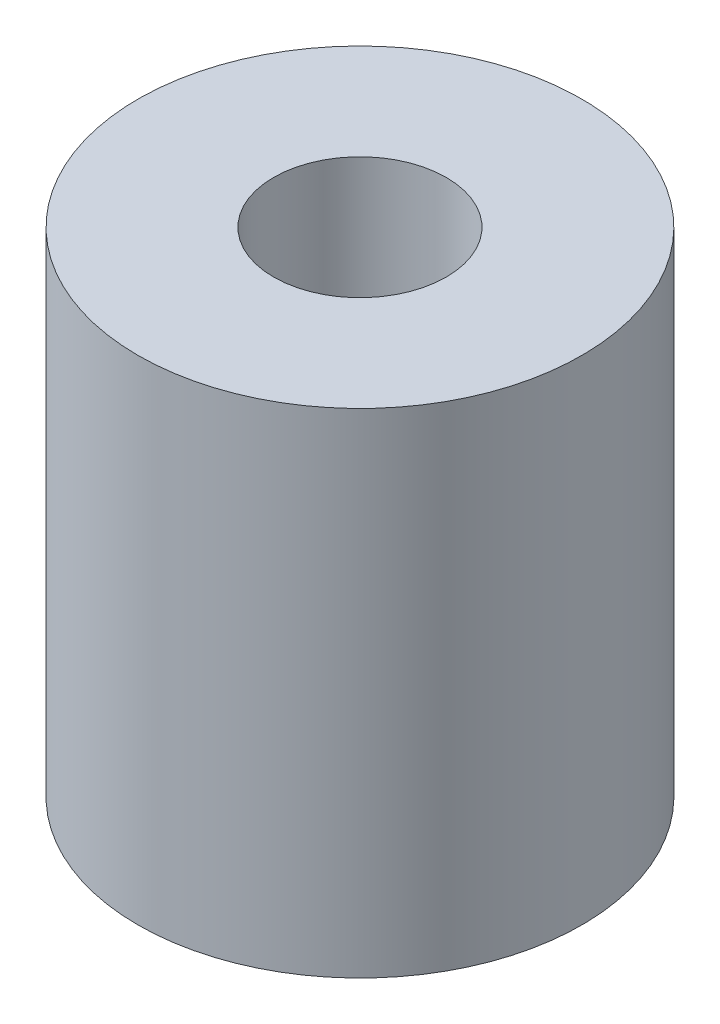
from build123d import *

# Parameters (mm, degrees)
SKETCH_2_R      = 4.5
SKETCH_2_R_2    = 1.75
EXTRUDE_1_DEPTH = 10


with BuildPart() as part:
    # 草图2 → 凸台-拉伸1 (new body)
    with BuildSketch(Plane(origin=(0, 0, 0), x_dir=(1, 0, 0), z_dir=(0, 1, 0))):
        with Locations(Location((0, 0, 0), (0, 0, 270))):
            Circle(SKETCH_2_R)
        with Locations(Location((0, 0, 0), (0, 0, 270))):
            Circle(SKETCH_2_R_2, mode=Mode.SUBTRACT)
    extrude(amount=EXTRUDE_1_DEPTH)


solid = part.part
